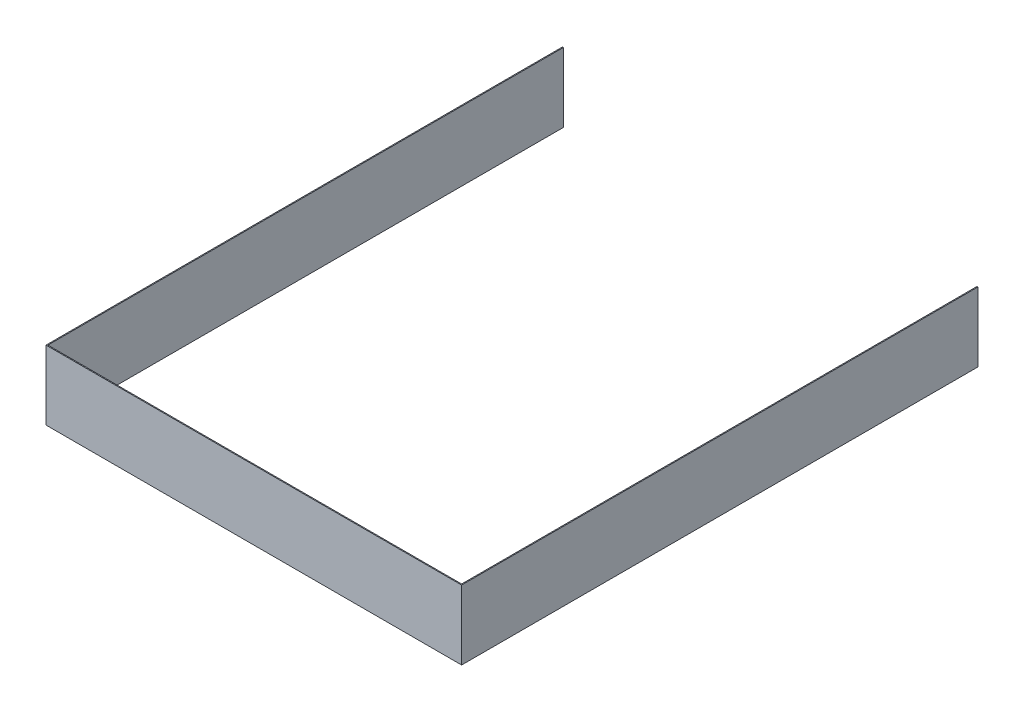
from build123d import *

# Parameters (mm, degrees)
OVEN_PLINT_U_1_START = 10
OVEN_PLINT_U_1_DEPTH = 110


with BuildPart() as part:
    # Sketch1 → OVEN_plint_U_1 (new body)
    with BuildSketch(Plane(origin=(0, 0, 0), x_dir=(1, 0, 0), z_dir=(0, 1, 0)).offset(OVEN_PLINT_U_1_START)):
        Polygon((20, 800), (20, -20), (680, -20), (680, 800), (678.5, 800), (678.5, -18.5), (21.5, -18.5), (21.5, 800), align=None)
    extrude(amount=OVEN_PLINT_U_1_DEPTH)


solid = part.part
